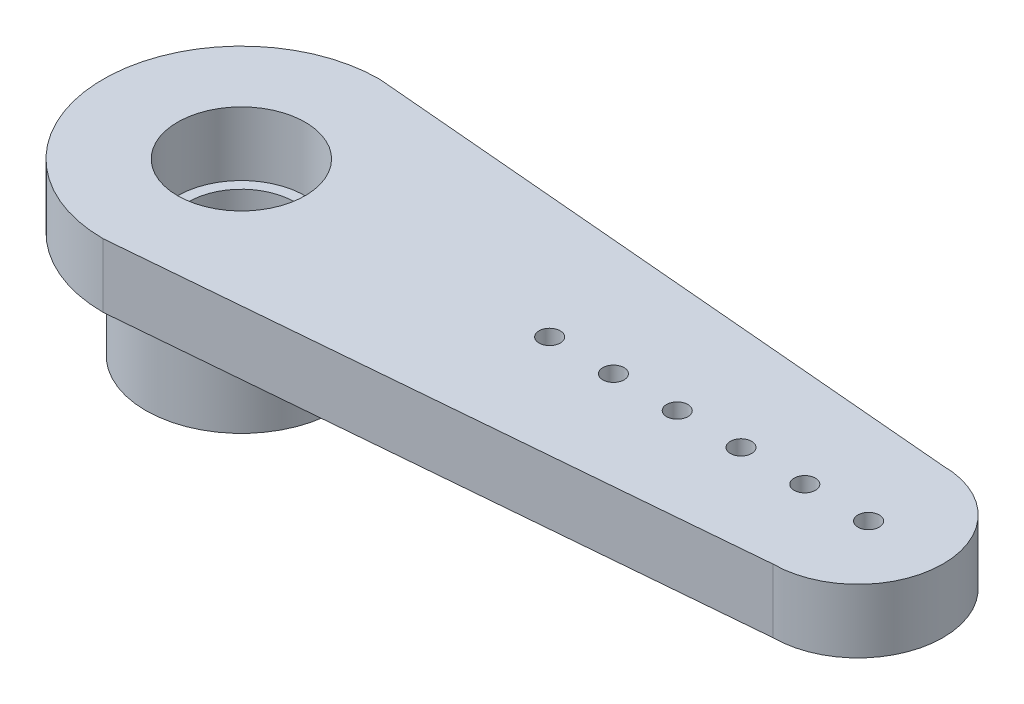
from build123d import *

# Parameters (mm, degrees)
SKETCH1_R           = 0.5
BOSS_EXTRUDE1_DEPTH = 3
SKETCH3_R           = 4.5
SKETCH3_R_2         = 2.5
BOSS_EXTRUDE2_DEPTH = 5
SKETCH4_R           = 3
CUT_EXTRUDE1_DEPTH  = 3


with BuildPart() as part:
    # Sketch1 → Boss-Extrude1 (new body)
    with BuildSketch(Plane(origin=(0, 0, 0), x_dir=(1, 0, 0), z_dir=(0, 1, 0))):
        with BuildLine():
            Line((0, 6.5), (29, 4))
            ThreePointArc((29, 4), (33, 0), (29, -4))
            Line((29, -4), (0, -6.5))
            ThreePointArc((0, -6.5), (-6.5, 0), (0, 6.5))
        make_face()
        with Locations(Location((14.5, 0, 0), (0, 0, 270))):
            Circle(SKETCH1_R, mode=Mode.SUBTRACT)
        with Locations(Location((17.5, 0, 0), (0, 0, 270))):
            Circle(SKETCH1_R, mode=Mode.SUBTRACT)
        with Locations(Location((20.5, 0, 0), (0, 0, 270))):
            Circle(SKETCH1_R, mode=Mode.SUBTRACT)
        with Locations(Location((23.5, 0, 0), (0, 0, 270))):
            Circle(SKETCH1_R, mode=Mode.SUBTRACT)
        with Locations(Location((26.5, 0, 0), (0, 0, 270))):
            Circle(SKETCH1_R, mode=Mode.SUBTRACT)
        with Locations(Location((29.5, 0, 0), (0, 0, 270))):
            Circle(SKETCH1_R, mode=Mode.SUBTRACT)
    extrude(amount=BOSS_EXTRUDE1_DEPTH)

    # Sketch3 → Boss-Extrude2 (add)
    with BuildSketch(Plane.XZ):
        with Locations(Location((0, 0, 0), (0, 0, 90))):
            Circle(SKETCH3_R)
        with Locations(Location((0, 0, 0), (0, 0, 270))):
            Circle(SKETCH3_R_2, mode=Mode.SUBTRACT)
    extrude(amount=BOSS_EXTRUDE2_DEPTH)

    # Sketch4 → Cut-Extrude1 (cut)
    with BuildSketch(Plane(origin=(0, 3, 0), x_dir=(1, 0, 0), z_dir=(0, 1, 0))):
        with Locations(Location((0, 0, 0), (0, 0, 270))):
            Circle(SKETCH4_R)
    extrude(amount=-CUT_EXTRUDE1_DEPTH, mode=Mode.SUBTRACT)


solid = part.part
